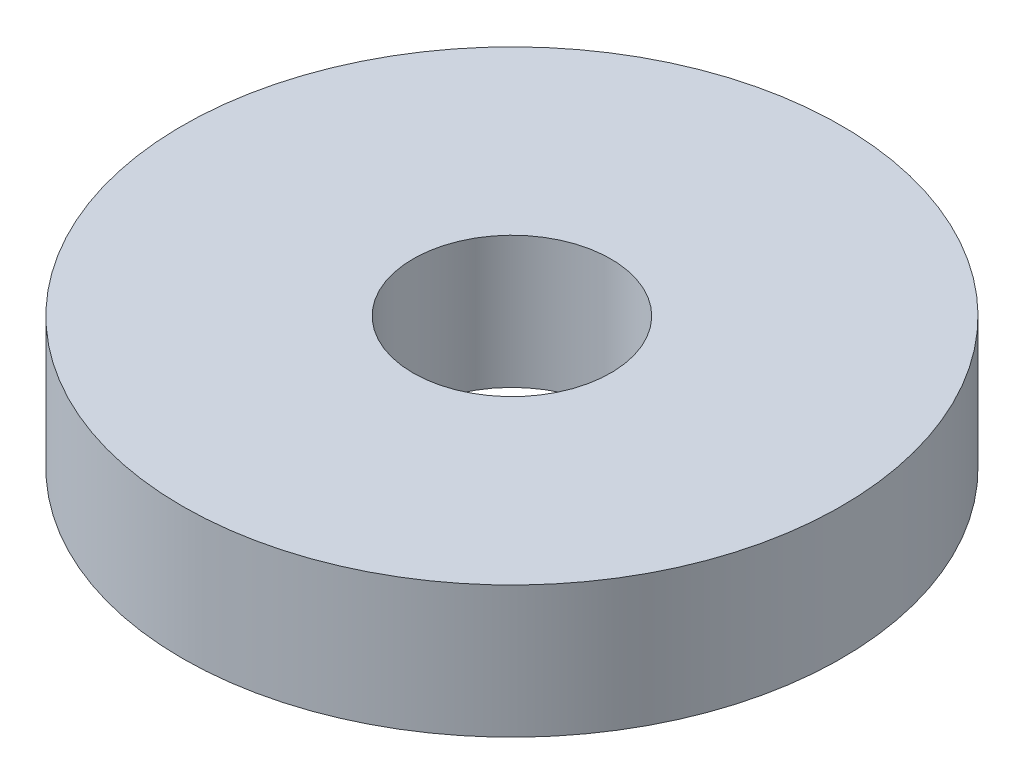
from build123d import *

# Parameters (mm, degrees)
SKETCH_1_R      = 10
SKETCH_1_R_2    = 3
EXTRUDE_1_DEPTH = 4


with BuildPart() as part:
    # 草图1 → 凸台-拉伸1 (new body)
    with BuildSketch(Plane(origin=(0, 0, 0), x_dir=(1, 0, 0), z_dir=(0, 1, 0))):
        with Locations(Location((0, 0, 0), (0, 0, 270))):
            Circle(SKETCH_1_R)
        with Locations(Location((0, 0, 0), (0, 0, 270))):
            Circle(SKETCH_1_R_2, mode=Mode.SUBTRACT)
    extrude(amount=EXTRUDE_1_DEPTH)


solid = part.part
